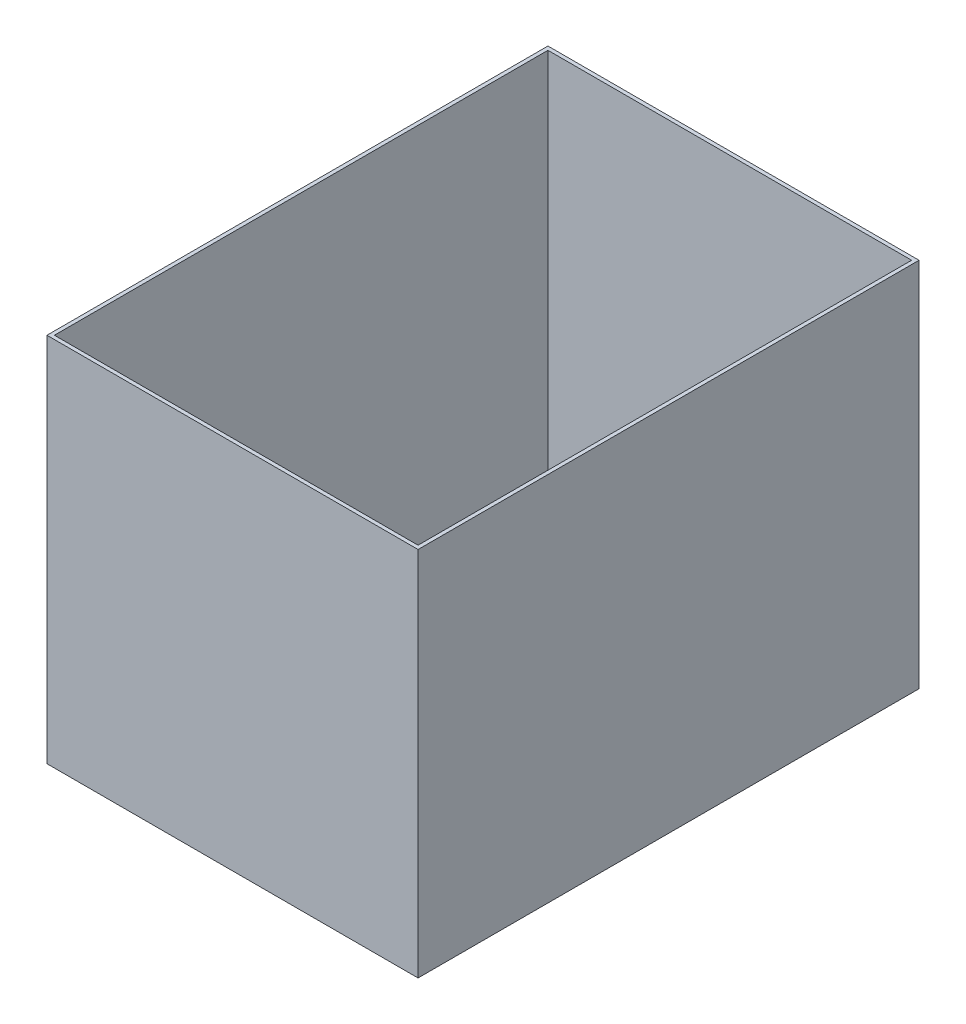
from build123d import *

# Parameters (mm, degrees)
SKETCH_1_W          = 200
SKETCH_1_H          = 270
EXTRUDE_1_DEPTH     = 200
SHELL_1_T           = -2
SKETCH_2_R          = 3.5
CUT_EXTRUDE_1_DEPTH = 10


with BuildPart() as part:
    # 草图1 → 凸台-拉伸1 (new body)
    with BuildSketch(Plane(origin=(0, 0, 0), x_dir=(1, 0, 0), z_dir=(0, 1, 0))):
        Rectangle(SKETCH_1_W, SKETCH_1_H)
    extrude(amount=EXTRUDE_1_DEPTH)

    # 抽壳1
    shell_1_openings = [part.faces().sort_by_distance(p)[0] for p in [
        (0, 200, 0),
    ]]
    offset(amount=SHELL_1_T, openings=shell_1_openings, kind=Kind.INTERSECTION)

    # 草图2 → 切除-拉伸1 (cut)
    with BuildSketch(Plane(origin=(0, 0, 0), x_dir=(-1, 0, 0), z_dir=(0, -1, 0))):
        with Locations(Location((90, -125, 0), (0, 0, 90))):
            Circle(SKETCH_2_R)
        with Locations(Location((-90, -125, 0), (0, 0, 90))):
            Circle(SKETCH_2_R)
        with Locations(Location((-90, 125, 0), (0, 0, 90))):
            Circle(SKETCH_2_R)
        with Locations(Location((90, 125, 0), (0, 0, 90))):
            Circle(SKETCH_2_R)
    extrude(amount=-CUT_EXTRUDE_1_DEPTH, mode=Mode.SUBTRACT)


solid = part.part
